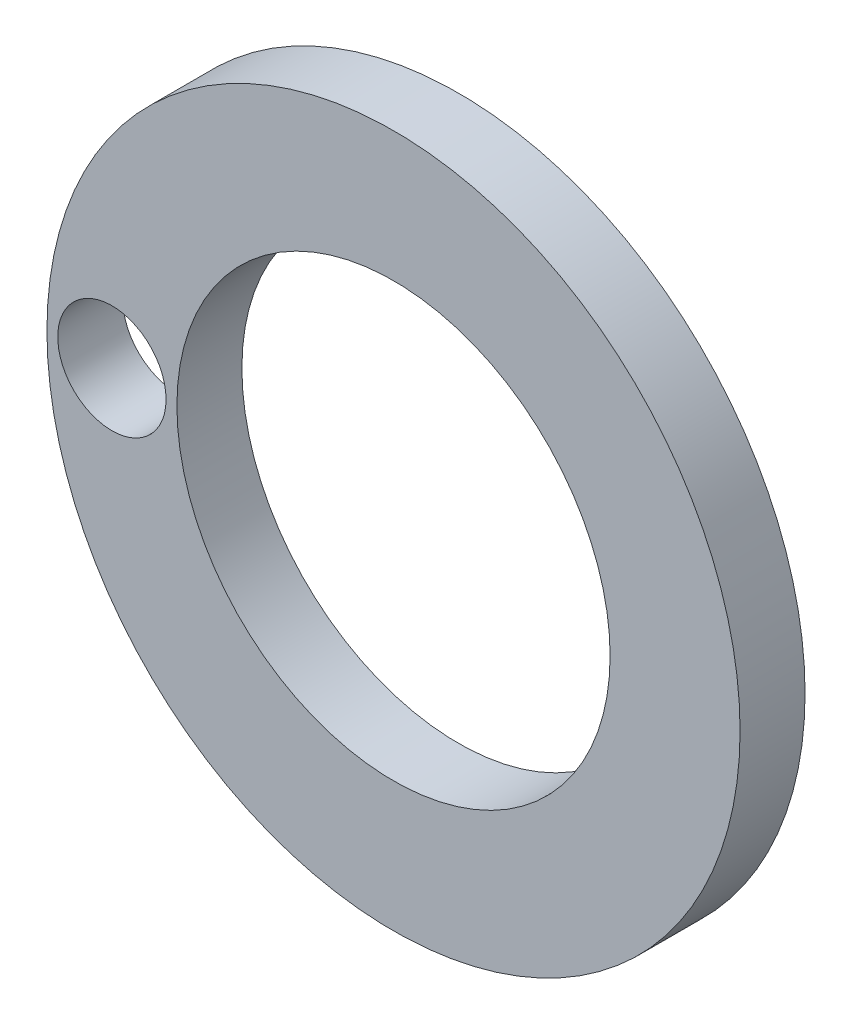
from build123d import *

# Parameters (mm, degrees)
SKETCH1_R           = 16
SKETCH1_R_2         = 10
SKETCH1_R_3         = 2.5
BOSS_EXTRUDE1_DEPTH = 3
SCALE1_SCALE        = 1.9329
SCALE2_SCALE        = 1.5


with BuildPart() as part:
    # Sketch1 → Boss-Extrude1 (new body)
    with BuildSketch(Plane.XY):
        Circle(SKETCH1_R)
        Circle(SKETCH1_R_2, mode=Mode.SUBTRACT)
        with Locations((-13, 0)):
            Circle(SKETCH1_R_3, mode=Mode.SUBTRACT)
    extrude(amount=BOSS_EXTRUDE1_DEPTH)


with BuildPart() as part_1:
    # Scale1: scaled about (0.542570952, 0, 1.5)
    add(part.part.scale(SCALE1_SCALE).moved(Location((-0.506164441, 0, -1.39935))))


with BuildPart() as part_2:
    # Scale2: scaled about (0.542570951, 0, 1.5)
    add(part_1.part.scale(SCALE2_SCALE).moved(Location((-0.271285475, 0, -0.75))))


solid = part_2.part
